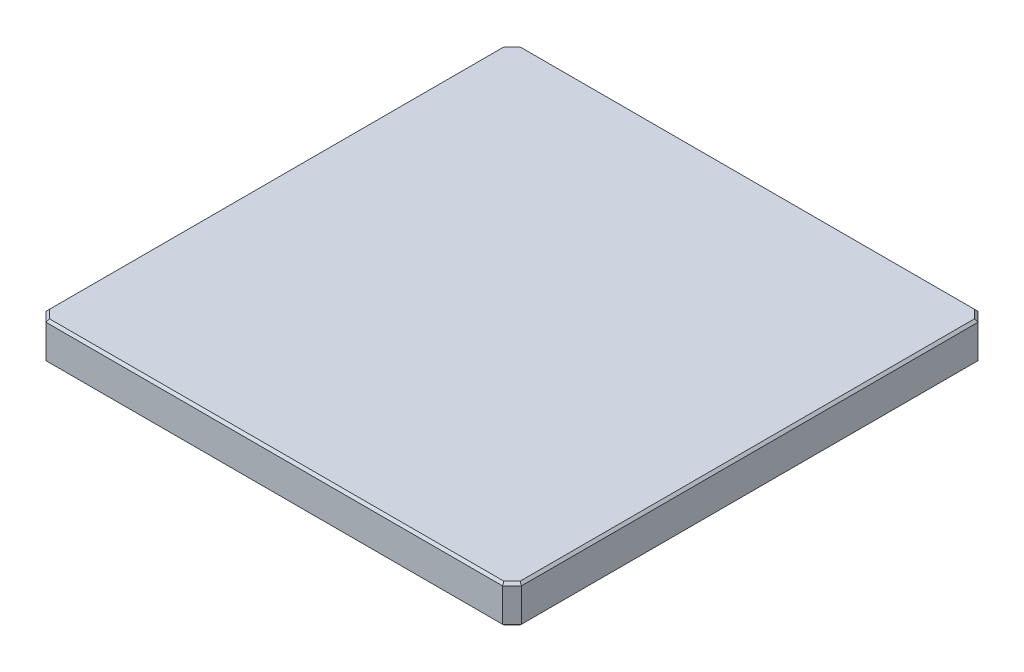
from build123d import *

# Parameters (mm, degrees)
SKETCH1_W           = 100
SKETCH1_H           = 8
BOSS_EXTRUDE1_DEPTH = 100
CHAMFER1_SIZE       = 2
CHAMFER2_SIZE       = 0.5


with BuildPart() as part:
    # Sketch1 → Boss-Extrude1 (new body)
    with BuildSketch(Plane.XY):
        with Locations((0, 4)):
            Rectangle(SKETCH1_W, SKETCH1_H)
    extrude(amount=BOSS_EXTRUDE1_DEPTH)

    # Chamfer1
    chamfer1_edges = [part.edges().sort_by_distance(p)[0] for p in [
        (-50, 4, 100),
        (50, 4, 100),
        (-50, 4, 0),
        (50, 4, 0),
    ]]
    chamfer(chamfer1_edges, length=CHAMFER1_SIZE)

    # Chamfer2
    chamfer2_edges = [part.edges().sort_by_distance(p)[0] for p in [
        (-50, 0, 50),
        (-50, 8, 50),
        (0, 0, 0),
        (50, 0, 50),
        (0, 0, 100),
        (49, 0, 99),
        (-49, 0, 99),
        (49, 0, 1),
        (-49, 0, 1),
        (0, 8, 0),
        (0, 8, 100),
        (50, 8, 50),
        (49, 8, 99),
        (-49, 8, 99),
        (49, 8, 1),
        (-49, 8, 1),
    ]]
    chamfer(chamfer2_edges, length=CHAMFER2_SIZE)


solid = part.part
